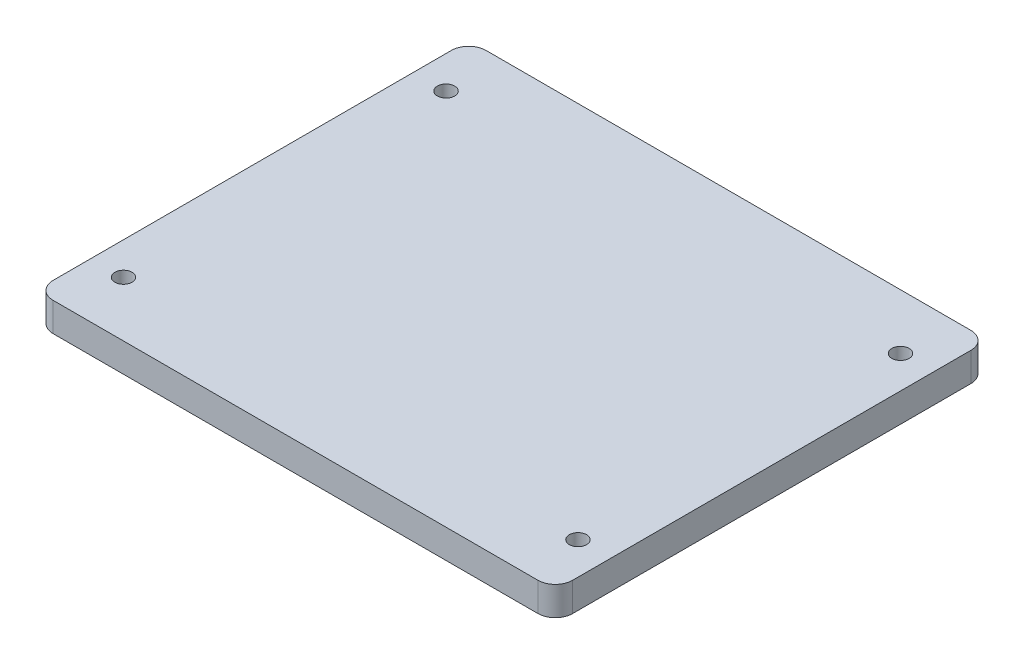
from build123d import *

# Parameters (mm, degrees)
SKETCH1_W           = 90
SKETCH1_H           = 75
BOSS_EXTRUDE1_DEPTH = 5
SKETCH2_R           = 1.5
CUT_EXTRUDE1_DEPTH  = 5
SKETCH3_R           = 4.5
CUT_EXTRUDE2_DEPTH  = 2
FILLET1_R           = 3


with BuildPart() as part:
    # Sketch1 → Boss-Extrude1 (new body)
    with BuildSketch(Plane(origin=(0, 0, 0), x_dir=(1, 0, 0), z_dir=(0, 1, 0))):
        Rectangle(SKETCH1_W, SKETCH1_H)
    extrude(amount=BOSS_EXTRUDE1_DEPTH)

    # Sketch2 → Cut-Extrude1 (cut)
    with BuildSketch(Plane(origin=(0, 5, 0), x_dir=(1, 0, 0), z_dir=(0, 1, 0))):
        with Locations(Location((-39.37, 27.94, 0), (0, 0, 270))):
            Circle(SKETCH2_R)
        with Locations(Location((39.37, 27.94, 0), (0, 0, 270))):
            Circle(SKETCH2_R)
        with Locations(Location((39.37, -27.94, 0), (0, 0, 270))):
            Circle(SKETCH2_R)
        with Locations(Location((-39.37, -27.94, 0), (0, 0, 270))):
            Circle(SKETCH2_R)
    extrude(amount=-CUT_EXTRUDE1_DEPTH, mode=Mode.SUBTRACT)

    # Sketch3 → Cut-Extrude2 (cut)
    with BuildSketch(Plane.XZ):
        with Locations(Location((-22.5, -32.5, 0), (0, 0, 270))):
            Circle(SKETCH3_R)
        with Locations(Location((-22.5, 32.5, 0), (0, 0, 270))):
            Circle(SKETCH3_R)
        with Locations(Location((22.5, 32.5, 0), (0, 0, 270))):
            Circle(SKETCH3_R)
        with Locations(Location((22.5, -32.5, 0), (0, 0, 270))):
            Circle(SKETCH3_R)
    extrude(amount=-CUT_EXTRUDE2_DEPTH, mode=Mode.SUBTRACT)

    # Fillet1
    fillet1_edges = [part.edges().sort_by_distance(p)[0] for p in [
        (45, 2.5, 37.5),
        (-45, 2.5, 37.5),
        (-45, 2.5, -37.5),
        (45, 2.5, -37.5),
    ]]
    fillet(fillet1_edges, radius=FILLET1_R)


solid = part.part
